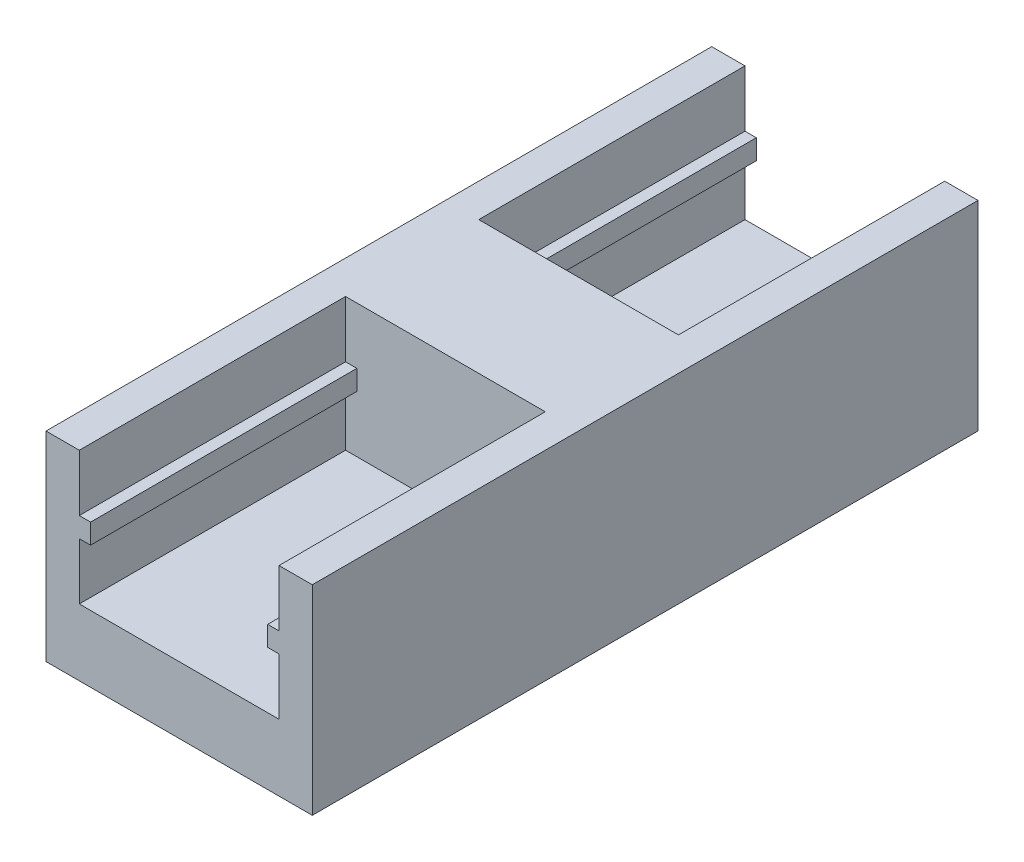
from build123d import *

# Parameters (mm, degrees)
SKETCH2_W           = 20
SKETCH2_H           = 15
BOSS_EXTRUDE1_DEPTH = 50
CUT_EXTRUDE2_DEPTH  = 20


with BuildPart() as part:
    # Sketch2 → Boss-Extrude1 (new body)
    with BuildSketch(Plane.XY):
        Rectangle(SKETCH2_W, SKETCH2_H)
    extrude(amount=BOSS_EXTRUDE1_DEPTH)

    # Sketch4 → Cut-Extrude2 (cut)
    with BuildSketch(Plane.XY.offset(50)):
        Polygon((-7.5, -2.5), (7.5, -2.5), (7.5, 1.75), (6.65, 1.75), (6.65, 3.25), (7.5, 3.25), (7.5, 7.5), (-7.5, 7.5), (-7.5, 3.25), (-6.65, 3.25), (-6.65, 1.75), (-7.5, 1.75), align=None)
    cut_extrude2 = extrude(amount=-CUT_EXTRUDE2_DEPTH, mode=Mode.SUBTRACT)

    # Mirror1: Cut-Extrude2 across plane
    add(cut_extrude2.mirror(Plane.XY.offset(25)), mode=Mode.SUBTRACT)


solid = part.part
